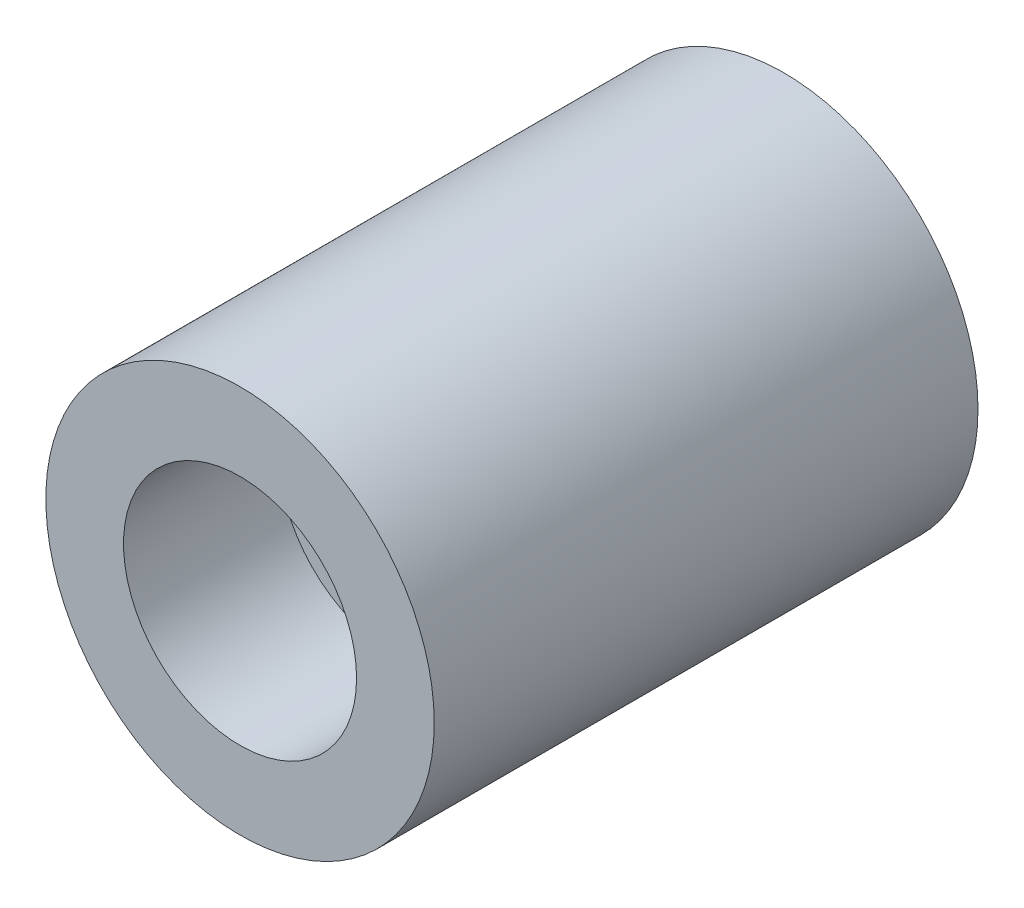
from build123d import *

# Parameters (mm, degrees)
SKETCH1_R           = 1270
BOSS_EXTRUDE1_DEPTH = 3556
SKETCH2_R           = 762
CUT_EXTRUDE1_DEPTH  = 1016
SKETCH3_R           = 254
CUT_EXTRUDE2_DEPTH  = 2032


with BuildPart() as part:
    # Sketch1 → Boss-Extrude1 (new body)
    with BuildSketch(Plane.XY):
        Circle(SKETCH1_R)
    extrude(amount=BOSS_EXTRUDE1_DEPTH)

    # Sketch2 → Cut-Extrude1 (cut)
    with BuildSketch(Plane.XY.offset(3556)):
        Circle(SKETCH2_R)
    extrude(amount=-CUT_EXTRUDE1_DEPTH, mode=Mode.SUBTRACT)

    # Sketch3 → Cut-Extrude2 (cut)
    with BuildSketch(Plane.XY.offset(2540)):
        Circle(SKETCH3_R)
    extrude(amount=-CUT_EXTRUDE2_DEPTH, mode=Mode.SUBTRACT)


solid = part.part
